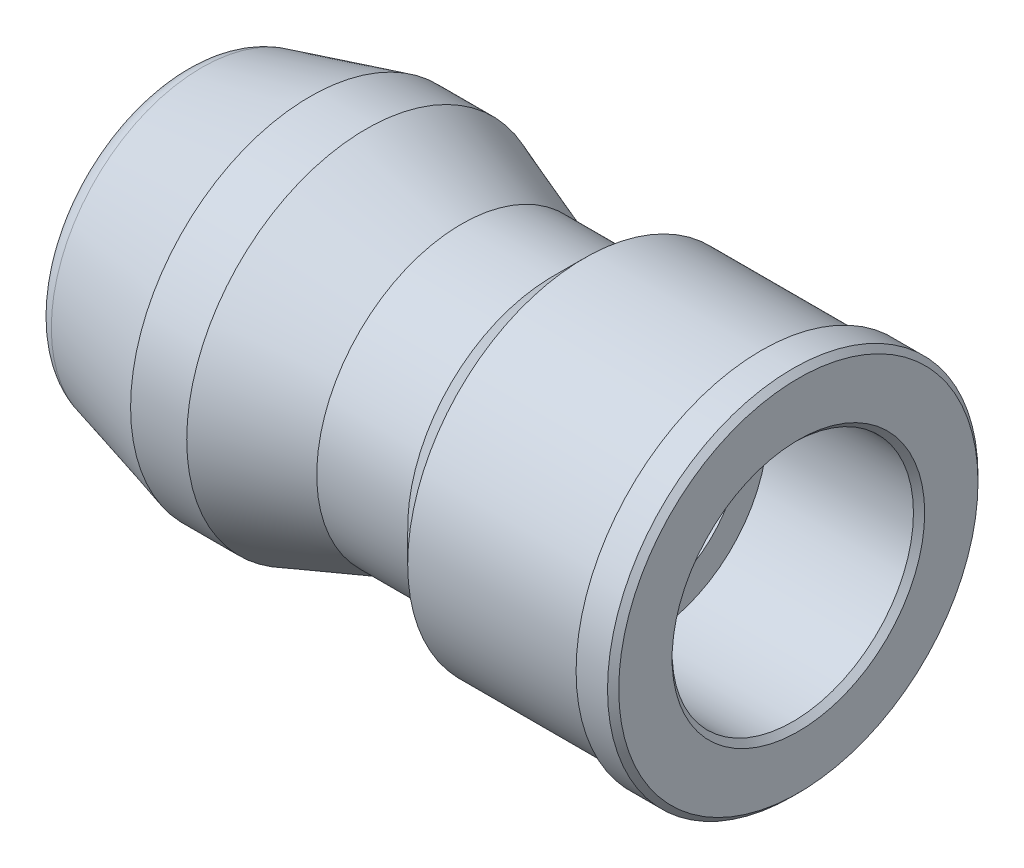
from build123d import *

# Parameters (mm, degrees)
M4_TAPPED_HOLE1_D           = 3.3
M4_TAPPED_HOLE1_CSINK_D     = 4.05
M4_TAPPED_HOLE1_CSINK_ANGLE = 45
FILLET1_R                   = 0.5
CHAMFER1_SIZE               = 0.1


with BuildPart() as part:
    # Sketch1 → Revolve1 (revolve)
    with BuildSketch(Plane.XY, mode=Mode.PRIVATE) as revolve1_sk:
        Polygon((5.889590125, 0), (0, 0), (0, 2.58), (2.3, 3.196283143), (3.3, 3.196283143), (5, 2.58), (6.62, 2.58), (7.19, 3.15), (10.34, 3.15), (10.34, 3.3), (11, 3.3), (11, 2.15), (8.3, 2.15), (8.3, 0), align=None)
    revolve(revolve1_sk.sketch.rotate(Axis((5.889590125, 0, 0), (-1, 0, 0)), 90), axis=Axis((5.889590125, 0, 0), (-1, 0, 0)))

    # M4 Tapped Hole1 (through all)
    with Locations(Plane.ZY):
        with Locations((0, 0)):
            CounterSinkHole(M4_TAPPED_HOLE1_D / 2, M4_TAPPED_HOLE1_CSINK_D / 2, counter_sink_angle=M4_TAPPED_HOLE1_CSINK_ANGLE)

    # Fillet1
    fillet1_edges = [part.edges().sort_by_distance(p)[0] for p in [
        (0, 0, 2.58),
    ]]
    fillet(fillet1_edges, radius=FILLET1_R)

    # Chamfer1
    chamfer1_edges = [part.edges().sort_by_distance(p)[0] for p in [
        (11, 0, 2.15),
        (11, 0, 3.3),
        (10.34, 0, 3.15),
    ]]
    chamfer(chamfer1_edges, length=CHAMFER1_SIZE)


solid = part.part
